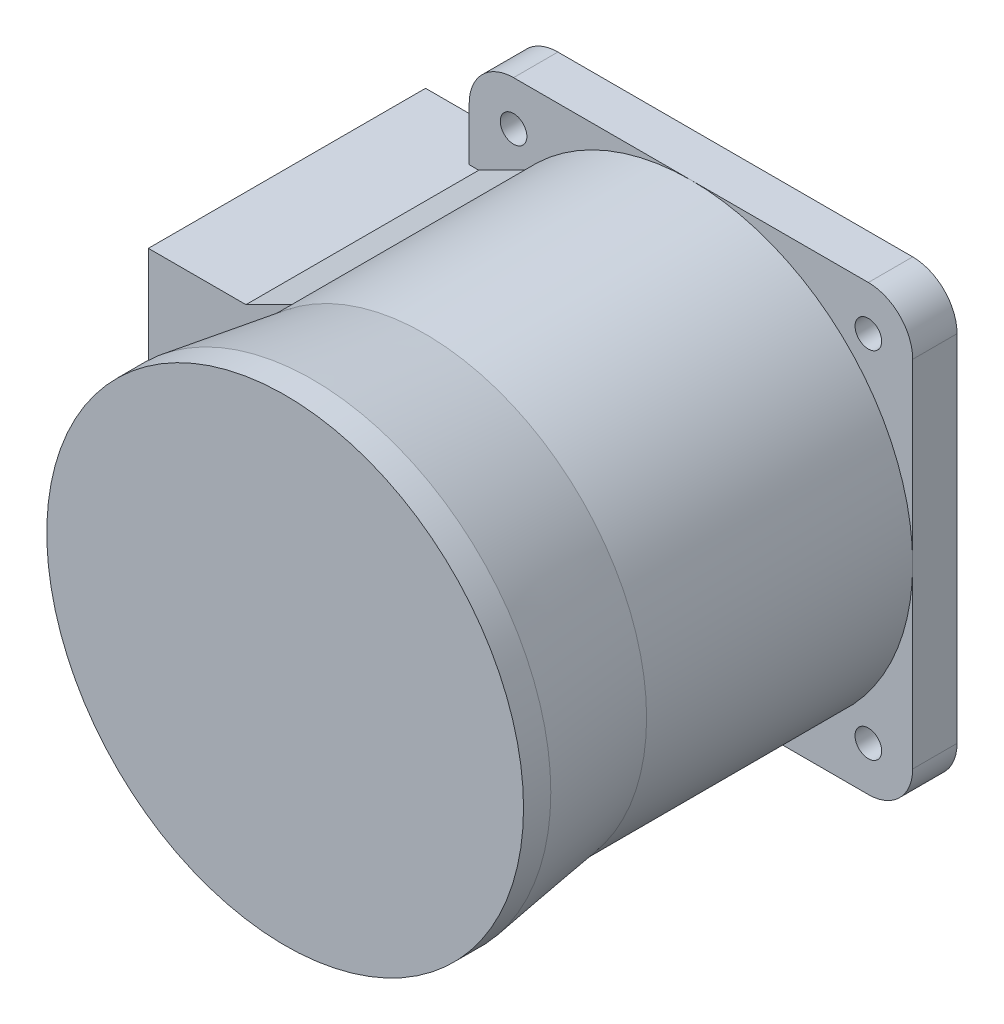
from build123d import *

# Parameters (mm, degrees)
SCHIZZO1_R                  = 6
PIASTRABASE_DEPTH           = 20
SCHIZZO2_R                  = 100
CORPOCILINDRICO_DEPTH       = 120
SCHIZZO3_R                  = 107.5
SCHIZZO4_R                  = 107.5
CORPOCILINDRICOFINALE_DEPTH = 12.3
PANNELLOCOMANDI_DEPTH       = 125


with BuildPart() as part:
    # Schizzo1 → PiastraBase (new body)
    with BuildSketch(Plane.XY):
        with BuildLine():
            Line((-80, -100), (80, -100))
            ThreePointArc((80, -100), (94.142135624, -94.142135624), (100, -80))
            Line((100, -80), (100, 80))
            ThreePointArc((100, 80), (94.142135624, 94.142135624), (80, 100))
            Line((80, 100), (-80, 100))
            ThreePointArc((-80, 100), (-94.142135624, 94.142135624), (-100, 80))
            Line((-100, 80), (-100, -80))
            ThreePointArc((-100, -80), (-94.142135624, -94.142135624), (-80, -100))
        make_face()
        with Locations((-80, 80)):
            Circle(SCHIZZO1_R, mode=Mode.SUBTRACT)
        with Locations(Location((-80, -80, 0), (0, 0, 180))):
            Circle(SCHIZZO1_R, mode=Mode.SUBTRACT)
        with Locations((80, -80)):
            Circle(SCHIZZO1_R, mode=Mode.SUBTRACT)
        with Locations(Location((80, 80, 0), (0, 0, 180))):
            Circle(SCHIZZO1_R, mode=Mode.SUBTRACT)
    extrude(amount=PIASTRABASE_DEPTH)

    # Schizzo2 → CorpoCilindrico (add)
    with BuildSketch(Plane.XY.offset(20)):
        Circle(SCHIZZO2_R)
    extrude(amount=CORPOCILINDRICO_DEPTH)

    # Schizzo3 → section 1 of loftcentrale
    with BuildSketch(Plane.XY.offset(190.7), mode=Mode.PRIVATE) as loftcentrale_s1:
        Circle(SCHIZZO3_R)
    # loft up to a face of the part (loftcentrale)
    loft([Face(Wire([part.edges().sort_by_distance((-68.454710593, 72.896862742, 140))[0]])), loftcentrale_s1.sketch])

    # Schizzo4 → CorpoCilindricoFinale (add)
    with BuildSketch(Plane.XY.offset(190.7)):
        Circle(SCHIZZO4_R)
    extrude(amount=CORPOCILINDRICOFINALE_DEPTH)

    # Schizzo5 → PannelloComandi (add)
    with BuildSketch(Plane.XY):
        with BuildLine():
            Line((-95.684335707, 56), (-139.684335707, 56))
            Line((-139.684335707, 56), (-139.684335707, -56))
            Line((-139.684335707, -56), (-95.684335707, -56))
            Line((-95.684335707, -56), (-74.684335707, -66.5))
            ThreePointArc((-74.684335707, -66.5), (-93.45703176, -35.577847246), (-100, 0))
            ThreePointArc((-100, 0), (-93.45703176, 35.577847246), (-74.684335707, 66.5))
            Line((-74.684335707, 66.5), (-95.684335707, 56))
        make_face()
    extrude(amount=PANNELLOCOMANDI_DEPTH)


solid = part.part
